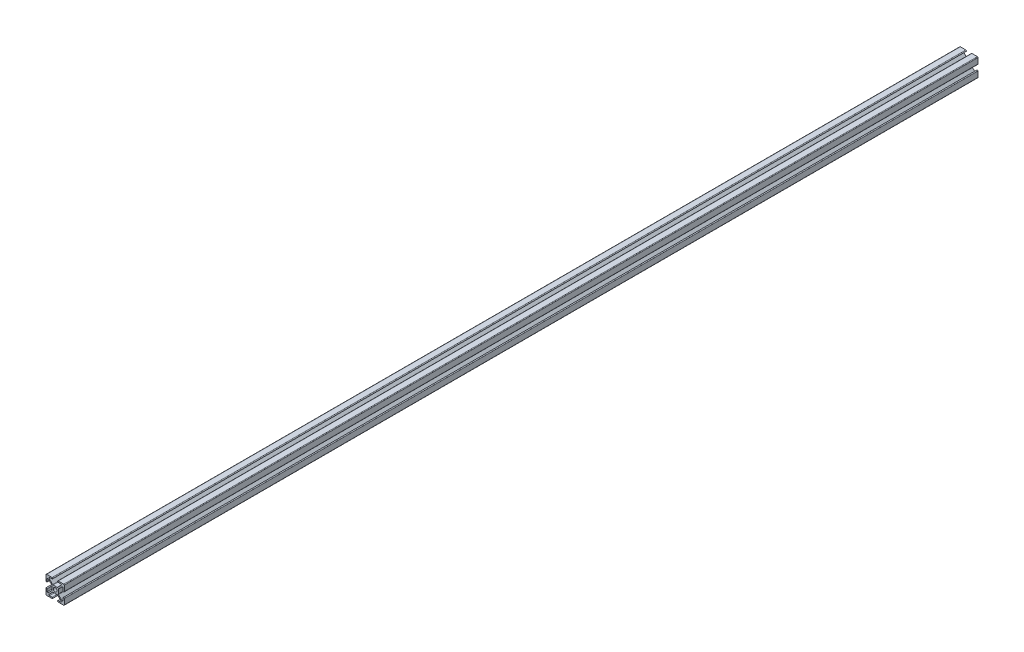
from build123d import *

# Parameters (mm, degrees)
SALIENTE_EXTRUIR1_DEPTH = 1500
CROQUIS2_R              = 3
CORTAR_EXTRUIR1_DEPTH   = 1501.149992501
CORTAR_EXTRUIR3_DEPTH   = 1501.149992501


with BuildPart() as part:
    # Croquis1 → Saliente-Extruir1 (new body)
    with BuildSketch(Plane.XY):
        with BuildLine():
            Line((-14, 15), (14, 15))
            ThreePointArc((14, 15), (14.707106781, 14.707106781), (15, 14))
            Line((15, 14), (15, -14))
            ThreePointArc((15, -14), (14.707106781, -14.707106781), (14, -15))
            Line((14, -15), (-14, -15))
            ThreePointArc((-14, -15), (-14.707106781, -14.707106781), (-15, -14))
            Line((-15, -14), (-15, 14))
            ThreePointArc((-15, 14), (-14.707106781, 14.707106781), (-14, 15))
        make_face()
    extrude(amount=-SALIENTE_EXTRUIR1_DEPTH)

    # Croquis2 → Cortar-Extruir1 (cut, through all)
    with BuildSketch(Plane.XY):
        Circle(CROQUIS2_R)
    extrude(amount=-CORTAR_EXTRUIR1_DEPTH, mode=Mode.SUBTRACT)

    # Croquis3 → Cortar-Extruir3 (cut, through all)
    with BuildSketch(Plane.XY):
        with BuildLine():
            Line((-5.492893219, 4.078679656), (-11.292893219, 9.878679656))
            ThreePointArc((-11.292893219, 9.878679656), (-12.382683432, 10.095452408), (-13, 9.171572875))
            Line((-13, 9.171572875), (-13, 5))
            ThreePointArc((-13, 5), (-14, 4), (-15, 5))
            Line((-15, 5), (-15, -5))
            ThreePointArc((-15, -5), (-14, -4), (-13, -5))
            Line((-13, -5), (-13, -9.171572875))
            ThreePointArc((-13, -9.171572875), (-12.382683432, -10.095452408), (-11.292893219, -9.878679656))
            Line((-11.292893219, -9.878679656), (-5.492893219, -4.078679656))
            ThreePointArc((-5.492893219, -4.078679656), (-5.276120467, -3.754256308), (-5.2, -3.371572875))
            Line((-5.2, -3.371572875), (-5.2, 3.371572875))
            ThreePointArc((-5.2, 3.371572875), (-5.276120467, 3.754256308), (-5.492893219, 4.078679656))
        make_face()
        with BuildLine():
            ThreePointArc((-9.171572875, 13), (-10.095452408, 12.382683432), (-9.878679656, 11.292893219))
            Line((-9.878679656, 11.292893219), (-4.078679656, 5.492893219))
            ThreePointArc((-4.078679656, 5.492893219), (-3.754256308, 5.276120467), (-3.371572875, 5.2))
            Line((-3.371572875, 5.2), (3.371572875, 5.2))
            ThreePointArc((3.371572875, 5.2), (3.754256308, 5.276120467), (4.078679656, 5.492893219))
            Line((4.078679656, 5.492893219), (9.878679656, 11.292893219))
            ThreePointArc((9.878679656, 11.292893219), (10.095452408, 12.382683432), (9.171572875, 13))
            Line((9.171572875, 13), (5, 13))
            ThreePointArc((5, 13), (4, 14), (5, 15))
            Line((5, 15), (-5, 15))
            ThreePointArc((-5, 15), (-4.292893219, 14.707106781), (-4, 14))
            ThreePointArc((-4, 14), (-4.292893219, 13.292893219), (-5, 13))
            Line((-5, 13), (-9.171572875, 13))
        make_face()
        with BuildLine():
            Line((9.878679656, -11.292893219), (4.078679656, -5.492893219))
            ThreePointArc((4.078679656, -5.492893219), (3.754256308, -5.276120467), (3.371572875, -5.2))
            Line((3.371572875, -5.2), (-3.371572875, -5.2))
            ThreePointArc((-3.371572875, -5.2), (-3.754256308, -5.276120467), (-4.078679656, -5.492893219))
            Line((-4.078679656, -5.492893219), (-9.878679656, -11.292893219))
            ThreePointArc((-9.878679656, -11.292893219), (-10.095452408, -12.382683432), (-9.171572875, -13))
            Line((-9.171572875, -13), (-5, -13))
            ThreePointArc((-5, -13), (-4.292893219, -13.292893219), (-4, -14))
            ThreePointArc((-4, -14), (-4.292893219, -14.707106781), (-5, -15))
            Line((-5, -15), (5, -15))
            ThreePointArc((5, -15), (4, -14), (5, -13))
            Line((5, -13), (9.171572875, -13))
            ThreePointArc((9.171572875, -13), (10.095452408, -12.382683432), (9.878679656, -11.292893219))
        make_face()
        with BuildLine():
            ThreePointArc((13, 9.171572875), (12.382683432, 10.095452408), (11.292893219, 9.878679656))
            Line((11.292893219, 9.878679656), (5.492893219, 4.078679656))
            ThreePointArc((5.492893219, 4.078679656), (5.276120467, 3.754256308), (5.2, 3.371572875))
            Line((5.2, 3.371572875), (5.2, -3.371572875))
            ThreePointArc((5.2, -3.371572875), (5.276120467, -3.754256308), (5.492893219, -4.078679656))
            Line((5.492893219, -4.078679656), (11.292893219, -9.878679656))
            ThreePointArc((11.292893219, -9.878679656), (12.382683432, -10.095452408), (13, -9.171572875))
            Line((13, -9.171572875), (13, -5))
            ThreePointArc((13, -5), (14, -4), (15, -5))
            Line((15, -5), (15, 5))
            ThreePointArc((15, 5), (14, 4), (13, 5))
            Line((13, 5), (13, 9.171572875))
        make_face()
    extrude(amount=-CORTAR_EXTRUIR3_DEPTH, mode=Mode.SUBTRACT)


solid = part.part
